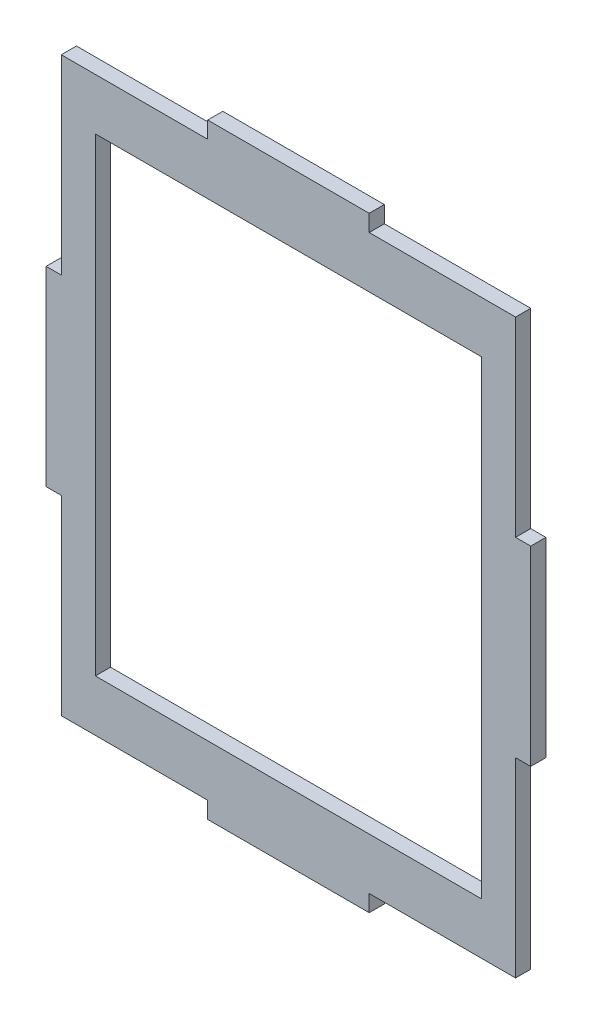
from build123d import *

# Parameters (mm, degrees)
SKETCH1_W           = 81.28
SKETCH1_H           = 101.6
BOSS_EXTRUDE1_DEPTH = 2.54
SKETCH2_W           = 27.093333333
SKETCH2_H           = 2.794
CUT_EXTRUDE4_DEPTH  = 66.105308539
SKETCH8_W           = 2.54
SKETCH8_H           = 32.004
CUT_EXTRUDE9_DEPTH  = 66.105308539
SKETCH9_W           = 64.77
SKETCH9_H           = 78.74
CUT_EXTRUDE10_DEPTH = 66.105308539


with BuildPart() as part:
    # Sketch1 → Boss-Extrude1 (new body)
    with BuildSketch(Plane.XY):
        Rectangle(SKETCH1_W, SKETCH1_H)
    extrude(amount=BOSS_EXTRUDE1_DEPTH)

    # Sketch2 → Cut-Extrude4 (cut, through all)
    with BuildSketch(Plane(origin=(0, 0, 0), x_dir=(-1, 0, 0), z_dir=(0, 0, -1))):
        with Locations((27.093333333, -49.403)):
            Rectangle(SKETCH2_W, SKETCH2_H)
        with Locations((-27.093333333, -49.403)):
            Rectangle(SKETCH2_W, SKETCH2_H)
        with Locations((-27.093333333, 49.403)):
            Rectangle(SKETCH2_W, SKETCH2_H)
        with Locations((27.093333333, 49.403)):
            Rectangle(SKETCH2_W, SKETCH2_H)
    extrude(amount=-CUT_EXTRUDE4_DEPTH, mode=Mode.SUBTRACT)

    # Sketch8 → Cut-Extrude9 (cut, through all)
    with BuildSketch(Plane.XY.offset(2.54)):
        with Locations((-39.37, -32.004)):
            Rectangle(SKETCH8_W, SKETCH8_H)
        with Locations((-39.37, 32.004)):
            Rectangle(SKETCH8_W, SKETCH8_H)
        with Locations((39.37, 32.004)):
            Rectangle(SKETCH8_W, SKETCH8_H)
        with Locations((39.37, -32.004)):
            Rectangle(SKETCH8_W, SKETCH8_H)
    extrude(amount=-CUT_EXTRUDE9_DEPTH, mode=Mode.SUBTRACT)

    # Sketch9 → Cut-Extrude10 (cut, through all)
    with BuildSketch(Plane.XY.offset(2.54)):
        Rectangle(SKETCH9_W, SKETCH9_H)
    extrude(amount=-CUT_EXTRUDE10_DEPTH, mode=Mode.SUBTRACT)


solid = part.part
